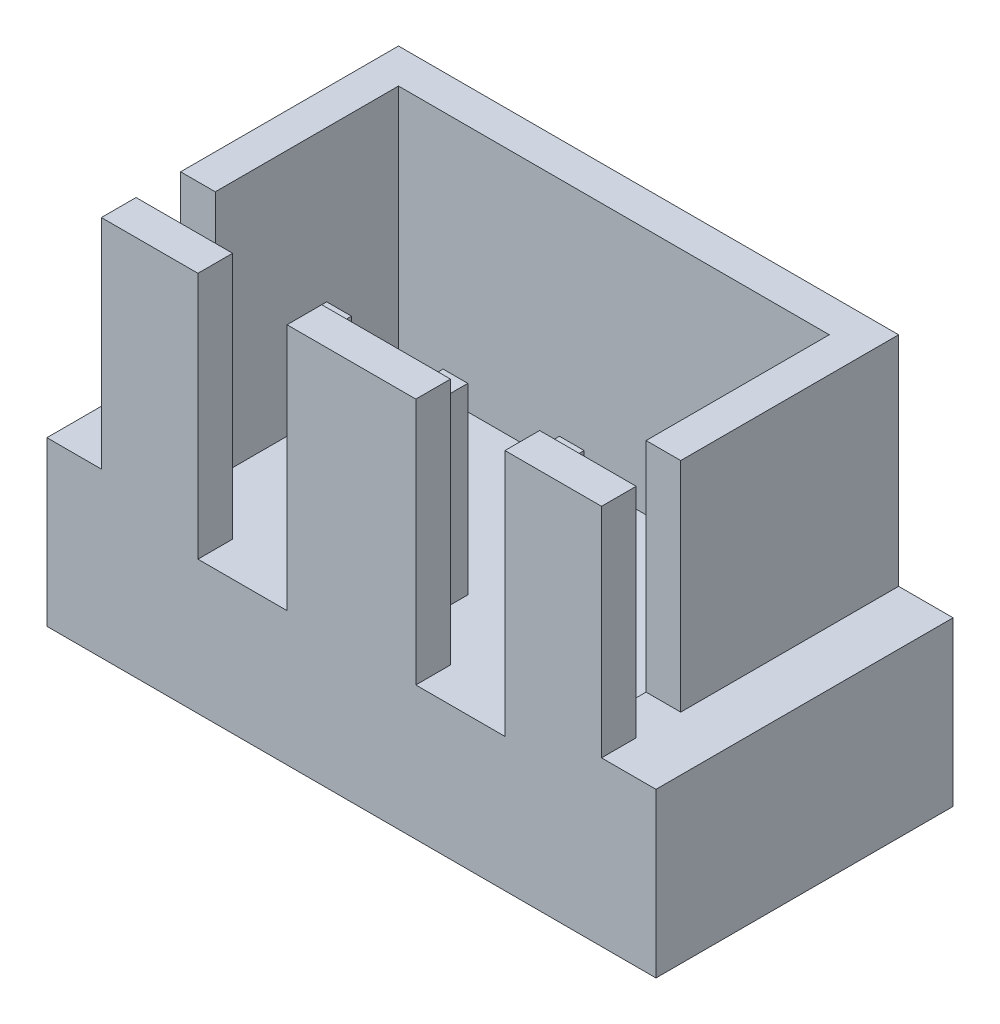
from build123d import *

# Parameters (mm, degrees)
SKETCH1_W           = 12.3
SKETCH1_H           = 6
BOSS_EXTRUDE1_DEPTH = 7.7
SKETCH2_W           = 8.7
SKETCH2_H           = 4.6
CUT_EXTRUDE1_DEPTH  = 5
SKETCH3_W           = 1.1
SKETCH3_H           = 6
CUT_EXTRUDE2_DEPTH  = 4.4
SKETCH4_W           = 1.8
SKETCH4_H           = 0.7
CUT_EXTRUDE3_DEPTH  = 5
SKETCH5_W           = 10.1
SKETCH5_H           = 0.9
CUT_EXTRUDE4_DEPTH  = 4.4
SKETCH6_W           = 0.5
SKETCH6_H           = 0.5
BOSS_EXTRUDE2_DEPTH = 3.7


with BuildPart() as part:
    # Sketch1 → Boss-Extrude1 (new body)
    with BuildSketch(Plane(origin=(0, 0, 0), x_dir=(1, 0, 0), z_dir=(0, 1, 0))):
        Rectangle(SKETCH1_W, SKETCH1_H)
    extrude(amount=BOSS_EXTRUDE1_DEPTH)

    # Sketch2 → Cut-Extrude1 (cut)
    with BuildSketch(Plane(origin=(0, 7.7, 0), x_dir=(1, 0, 0), z_dir=(0, 1, 0))):
        Rectangle(SKETCH2_W, SKETCH2_H)
    extrude(amount=-CUT_EXTRUDE1_DEPTH, mode=Mode.SUBTRACT)

    # Sketch3 → Cut-Extrude2 (cut)
    with BuildSketch(Plane(origin=(0, 7.7, 0), x_dir=(1, 0, 0), z_dir=(0, 1, 0))):
        with Locations((-5.6, 0)):
            Rectangle(SKETCH3_W, SKETCH3_H)
        with Locations((5.6, 0)):
            Rectangle(SKETCH3_W, SKETCH3_H)
    extrude(amount=-CUT_EXTRUDE2_DEPTH, mode=Mode.SUBTRACT)

    # Sketch4 → Cut-Extrude3 (cut)
    with BuildSketch(Plane(origin=(0, 7.7, 0), x_dir=(1, 0, 0), z_dir=(0, 1, 0))):
        with Locations((-2.2, -2.65)):
            Rectangle(SKETCH4_W, SKETCH4_H)
        with Locations((2.2, -2.65)):
            Rectangle(SKETCH4_W, SKETCH4_H)
    extrude(amount=-CUT_EXTRUDE3_DEPTH, mode=Mode.SUBTRACT)

    # Sketch5 → Cut-Extrude4 (cut)
    with BuildSketch(Plane(origin=(0, 7.7, 0), x_dir=(1, 0, 0), z_dir=(0, 1, 0))):
        with Locations((0, -1.85)):
            Rectangle(SKETCH5_W, SKETCH5_H)
    extrude(amount=-CUT_EXTRUDE4_DEPTH, mode=Mode.SUBTRACT)

    # Sketch6 → Boss-Extrude2 (add)
    with BuildSketch(Plane(origin=(0, 2.7, 0), x_dir=(1, 0, 0), z_dir=(0, 1, 0))):
        with Locations((0, -1.15)):
            Rectangle(SKETCH6_W, SKETCH6_H)
        with Locations((-2.35, -1.15)):
            Rectangle(SKETCH6_W, SKETCH6_H)
        with Locations((2.35, -1.15)):
            Rectangle(SKETCH6_W, SKETCH6_H)
    extrude(amount=BOSS_EXTRUDE2_DEPTH)


solid = part.part
